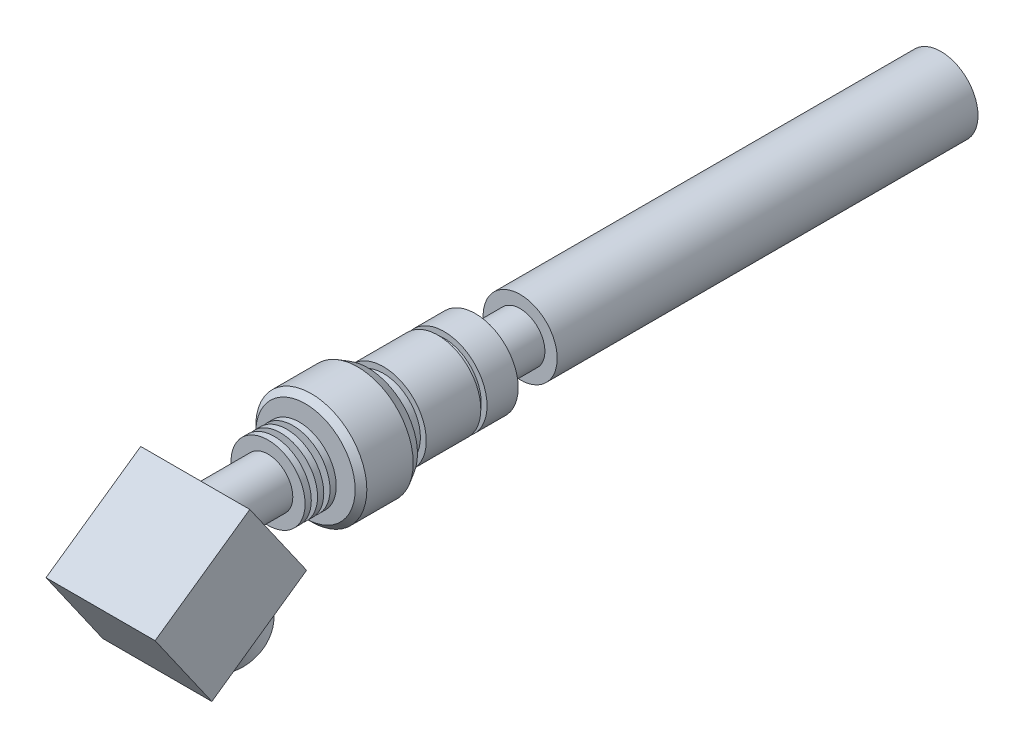
from build123d import *

# Parameters (mm, degrees)
SKETCH_1_R               = 9.5
EXTRUDE_1_DEPTH          = 108
SKETCH_2_R               = 6.35
EXTRUDE_2_DEPTH          = 11.5
SKETCH_3_R               = 11
EXTRUDE_3_DEPTH          = 8
SKETCH_4_R               = 9.5
EXTRUDE_4_DEPTH          = 1.6
SKETCH_5_R               = 11
EXTRUDE_5_DEPTH          = 14
SKETCH_6_R               = 9.5
EXTRUDE_6_DEPTH          = 4
SKETCH_7_R               = 14.25
EXTRUDE_7_DEPTH          = 16
CHAMFER_1_SIZE           = 1.5
CUT_EXTRUDE_1_DEPTH      = 195.148744523
CUT_EXTRUDE_1_DEPTH_BACK = 195.148744523
EXTRUDE_8_DEPTH          = 14
EXTRUDE_8_DEPTH_BACK     = 14
SKETCH_12_R              = 8
EXTRUDE_9_DEPTH          = 3.2
SKETCH_13_R              = 9.5
EXTRUDE_10_DEPTH         = 6.4
CHAMFER_2_SIZE           = 1.5
CHAMFER_2_SIZE2          = 2.598076211


with BuildPart() as part:
    # Эскиз1 → Бобышка-Вытянуть1 (new body)
    with BuildSketch(Plane.XY):
        Circle(SKETCH_1_R)
    extrude(amount=EXTRUDE_1_DEPTH)

    # Эскиз2 → Бобышка-Вытянуть2 (add)
    with BuildSketch(Plane.XY.offset(108)):
        Circle(SKETCH_2_R)
    extrude(amount=EXTRUDE_2_DEPTH)

    # Эскиз3 → Бобышка-Вытянуть3 (add)
    with BuildSketch(Plane.XY.offset(119.5)):
        Circle(SKETCH_3_R)
    extrude(amount=EXTRUDE_3_DEPTH)

    # Эскиз4 → Бобышка-Вытянуть4 (add)
    with BuildSketch(Plane.XY.offset(127.5)):
        Circle(SKETCH_4_R)
    extrude(amount=EXTRUDE_4_DEPTH)

    # Эскиз5 → Бобышка-Вытянуть5 (add)
    with BuildSketch(Plane.XY.offset(129.1)):
        Circle(SKETCH_5_R)
    extrude(amount=EXTRUDE_5_DEPTH)

    # Эскиз6 → Бобышка-Вытянуть6 (add)
    with BuildSketch(Plane.XY.offset(143.1)):
        Circle(SKETCH_6_R)
    extrude(amount=EXTRUDE_6_DEPTH)

    # Эскиз7 → Бобышка-Вытянуть7 (add)
    with BuildSketch(Plane.XY.offset(147.1)):
        Circle(SKETCH_7_R)
    extrude(amount=EXTRUDE_7_DEPTH)

    # Фаска1
    chamfer_1_edges = [part.edges().sort_by_distance(p)[0] for p in [
        (-14.25, 0, 163.1),
    ]]
    chamfer(chamfer_1_edges, length=CHAMFER_1_SIZE)

    # Эскиз8 → Повернуть1 (revolve)
    with BuildSketch(Plane(origin=(0, 0, 0), x_dir=(0, 0, -1), z_dir=(1, 0, 0))):
        Polygon((-163.1, 6.35), (-164.7, 6.35), (-164.7, 9.5), (-166.3, 9.5), (-166.3, 6.35), (-167.9, 6.35), (-167.9, 9.5), (-169.5, 9.5), (-169.5, 6.35), (-171.1, 6.35), (-171.1, 9.5), (-172.7, 9.5), (-172.7, 6.35), (-193.1, 6.35), (-193.1, 0), (-163.1, 0), align=None)
    revolve(axis=Axis((0, 0, 193.1), (0, 0, -1)))

    # Эскиз9 → Вырез-Вытянуть1 (cut, two sides: drawn at the far end of the back side and taken through both)
    with BuildSketch(Plane(origin=(0, 0, 0), x_dir=(0, 0, -1), z_dir=(1, 0, 0)).offset(-CUT_EXTRUDE_1_DEPTH_BACK)):
        Polygon((-179.653682132, -6.35), (-188.546317868, 6.35), (-193.1, 6.35), (-193.1, -6.35), align=None)
    extrude(amount=CUT_EXTRUDE_1_DEPTH + CUT_EXTRUDE_1_DEPTH_BACK, mode=Mode.SUBTRACT)

    # Эскиз10 → Бобышка-Вытянуть8 (add, two sides: drawn at the far end of the back side and taken through both)
    with BuildSketch(Plane(origin=(0, 0, 0), x_dir=(0, 0, -1), z_dir=(1, 0, 0)).offset(-EXTRUDE_8_DEPTH_BACK)):
        Polygon((-176.815579258, -10.403230962), (-191.384420742, 10.403230962), (-215.688134824, -6.614412844), (-201.119293341, -27.420874769), align=None)
    extrude(amount=EXTRUDE_8_DEPTH + EXTRUDE_8_DEPTH_BACK)

    # Эскиз12 → Бобышка-Вытянуть9 (add)
    with BuildSketch(Plane(origin=(0, 76.095474781, 53.282625065), x_dir=(1, 0, 0), z_dir=(0, -0.8191520442889946, -0.5735764363510424))):
        with Locations((0, 165.640569636)):
            Circle(SKETCH_12_R)
    extrude(amount=EXTRUDE_9_DEPTH)

    # Эскиз13 → Бобышка-Вытянуть10 (add)
    with BuildSketch(Plane(origin=(0, 73.474188239, 51.447180469), x_dir=(1, 0, 0), z_dir=(0, -0.8191520442889944, -0.5735764363510425))):
        with Locations((0, 165.640569636)):
            Circle(SKETCH_13_R)
    extrude(amount=EXTRUDE_10_DEPTH)

    # Фаска2
    chamfer_2_edges = [part.edges().sort_by_distance(p)[0] for p in [
        (-14.25, 0, 147.1),
    ]]
    chamfer_2_side = [part.faces().sort_by_distance(p)[0] for p in [
        (-13.846949135, 0, 147.1),
    ]]
    chamfer(chamfer_2_edges, length=CHAMFER_2_SIZE, length2=CHAMFER_2_SIZE2, reference=chamfer_2_side[0])


solid = part.part
